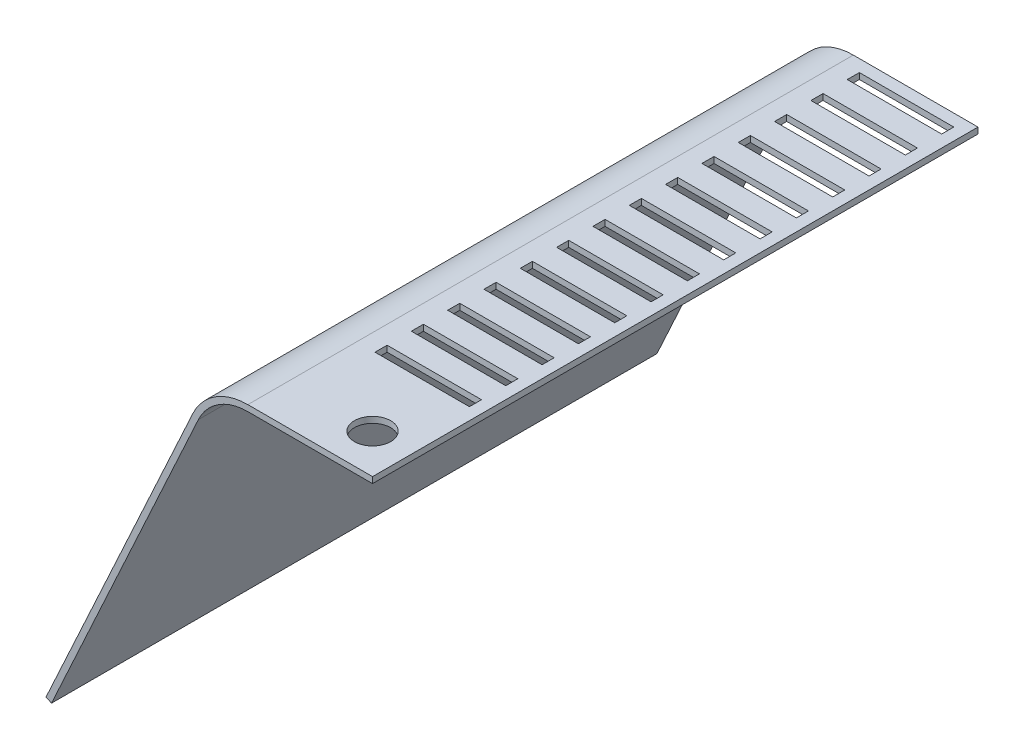
from build123d import *

# Parameters (mm, degrees)
EXTRUDE_THIN1_DEPTH = 500
SKETCH2_W           = 155.95
SKETCH2_H           = 20
CUT_EXTRUDE1_DEPTH  = 943.365495215
LPATTERN1_COUNT     = 14
LPATTERN1_PITCH     = 60
SKETCH3_R           = 30
CUT_EXTRUDE2_DEPTH  = 943.365495215


with BuildPart() as part:
    # Sketch1 → Extrude-Thin1 (new, symmetric)
    with BuildSketch(Plane.XY):
        with BuildLine():
            Line((0, 0), (-205.95, 0))
            ThreePointArc((-205.95, 0), (-259.885879639, -15.792394123), (-296.786225905, -58.181582248))
            Line((-296.786225905, -58.181582248), (-539.333048865, -585.0316925))
            Line((-539.333048865, -585.0316925), (-530.249426274, -589.213534275))
            Line((-530.249426274, -589.213534275), (-287.702603315, -62.363424024))
            ThreePointArc((-287.702603315, -62.363424024), (-254.492291675, -24.21315471), (-205.95, -10))
            Line((-205.95, -10), (0, -10))
            Line((0, -10), (0, 0))
        make_face()
    extrude(amount=EXTRUDE_THIN1_DEPTH, both=True)

    # Sketch2 → Cut-Extrude1 (cut, through all)
    with BuildSketch(Plane(origin=(0, 0, 0), x_dir=(1, 0, 0), z_dir=(0, 1, 0))):
        with Locations((-97.975, 470)):
            Rectangle(SKETCH2_W, SKETCH2_H)
    cut_extrude1 = extrude(amount=-CUT_EXTRUDE1_DEPTH, mode=Mode.SUBTRACT)

    # LPattern1: Cut-Extrude1 ×14
    with Locations(*[(0, 0, i * LPATTERN1_PITCH) for i in range(1, LPATTERN1_COUNT)]):
        add(cut_extrude1, mode=Mode.SUBTRACT)

    # Sketch3 → Cut-Extrude2 (cut, through all)
    with BuildSketch(Plane(origin=(0, 0, 0), x_dir=(1, 0, 0), z_dir=(0, 1, 0))):
        with Locations(Location((-65, -435, 0), (0, 0, 180))):
            Circle(SKETCH3_R)
    extrude(amount=-CUT_EXTRUDE2_DEPTH, mode=Mode.SUBTRACT)


solid = part.part
